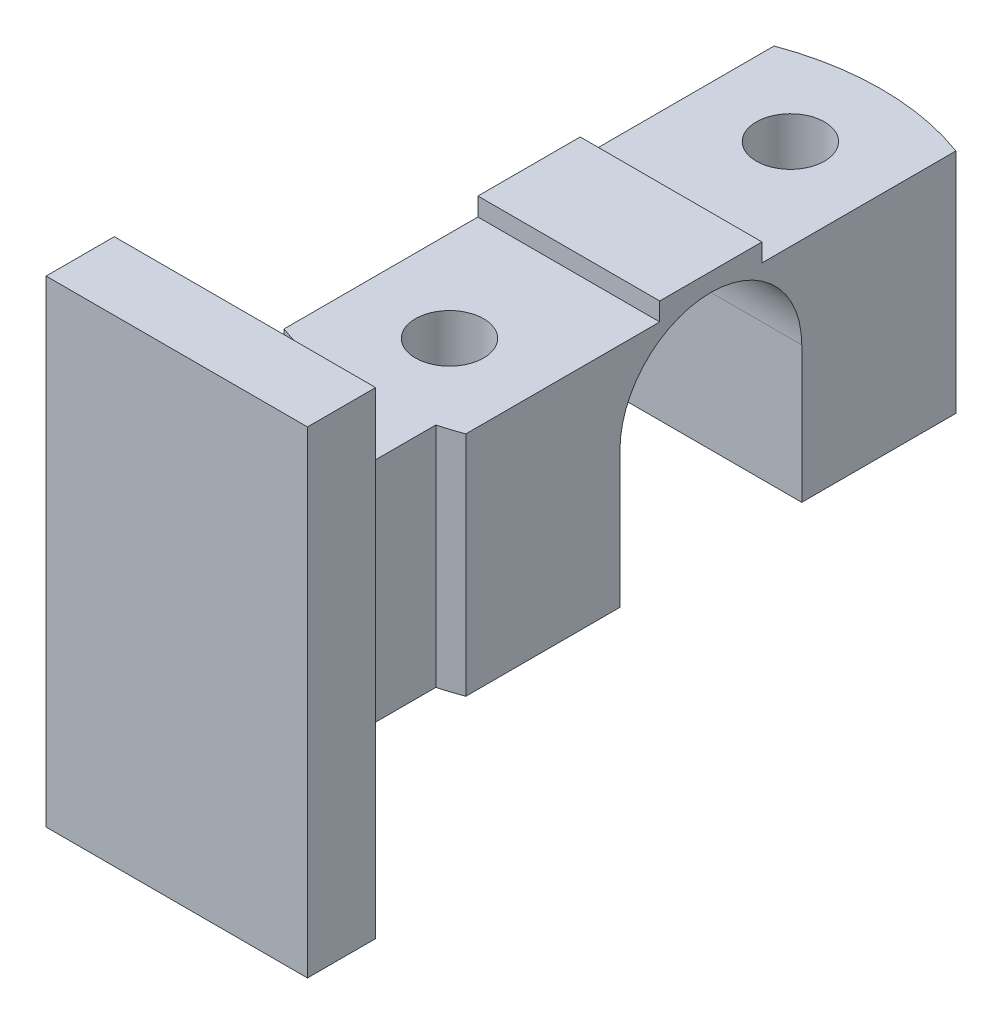
from build123d import *

# Parameters (mm, degrees)
SKETCH1_W           = 115
SKETCH1_H           = 210
BOSS_EXTRUDE1_DEPTH = 30
SKETCH3_W           = 60
SKETCH3_H           = 60
BOSS_EXTRUDE2_DEPTH = 50
SKETCH4_R           = 15
BOSS_EXTRUDE3_DEPTH = 50
FILLET1_R           = 10
SKETCH7_W           = 45
SKETCH7_H           = 8
BOSS_EXTRUDE6_DEPTH = 80
CUT_EXTRUDE1_DEPTH  = 226


with BuildPart() as part:
    # Sketch1 → Boss-Extrude1 (new body)
    with BuildSketch(Plane.XY):
        Rectangle(SKETCH1_W, SKETCH1_H)
    extrude(amount=BOSS_EXTRUDE1_DEPTH)

    # Sketch3 → Boss-Extrude2 (add, symmetric)
    with BuildSketch(Plane(origin=(0, 0, 0), x_dir=(1, 0, 0), z_dir=(0, 1, 0))):
        with Locations((0, 30)):
            Rectangle(SKETCH3_W, SKETCH3_H)
    extrude(amount=BOSS_EXTRUDE2_DEPTH, both=True)

    # Sketch4 → Boss-Extrude3 (add, symmetric)
    with BuildSketch(Plane(origin=(0, 0, 0), x_dir=(1, 0, 0), z_dir=(0, 1, 0))):
        with BuildLine():
            Line((-40, 272.819293264), (-40, 57.180706736))
            ThreePointArc((-40, 57.180706736), (0, 50), (40, 57.180706736))
            Line((40, 57.180706736), (40, 272.819293264))
            ThreePointArc((40, 272.819293264), (0, 280), (-40, 272.819293264))
        make_face()
        with Locations(Location((0, 240, 0), (0, 0, 270))):
            Circle(SKETCH4_R, mode=Mode.SUBTRACT)
        with Locations(Location((0, 90, 0), (0, 0, 270))):
            Circle(SKETCH4_R, mode=Mode.SUBTRACT)
    extrude(amount=BOSS_EXTRUDE3_DEPTH, both=True)

    # Fillet1
    fillet1_edges = [part.edges().sort_by_distance(p)[0] for p in [
        (0, -50, 0),
        (-30, 0, 0),
        (30, 0, 0),
        (0, 50, 0),
    ]]
    fillet(fillet1_edges, radius=FILLET1_R)

    # Sketch7 → Boss-Extrude6 (add)
    with BuildSketch(Plane.ZY.offset(40)):
        with Locations((-165, 54)):
            Rectangle(SKETCH7_W, SKETCH7_H)
    extrude(amount=-BOSS_EXTRUDE6_DEPTH)

    # Sketch11 → Cut-Extrude1 (cut)
    with BuildSketch(Plane.ZY.offset(40)):
        with BuildLine():
            Line((-205, 10), (-205, -50))
            Line((-205, -50), (-125, -50))
            Line((-125, -50), (-125, 10))
            ThreePointArc((-125, 10), (-165, 50), (-205, 10))
        make_face()
    extrude(amount=-CUT_EXTRUDE1_DEPTH, mode=Mode.SUBTRACT)


solid = part.part
